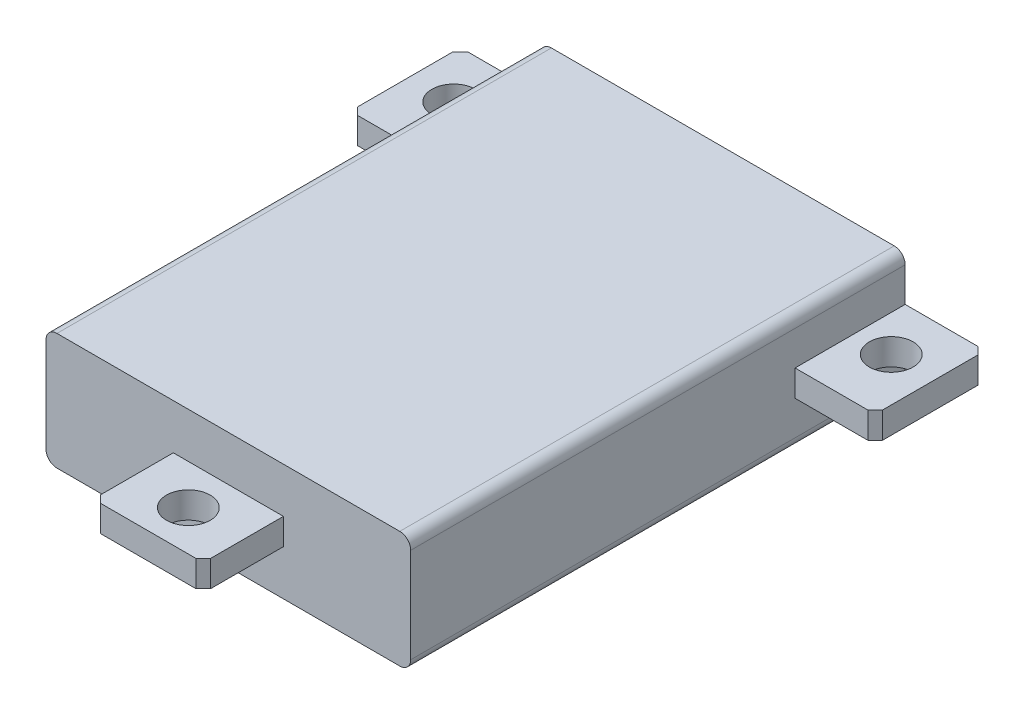
from build123d import *

# Parameters (mm, degrees)
SKETCH1_W           = 25.01
SKETCH1_H           = 33.905
BOSS_EXTRUDE1_DEPTH = 8
SKETCH2_W           = 7.55
SKETCH2_H           = 1.8
BOSS_EXTRUDE2_DEPTH = 5.495
SKETCH3_W           = 7.55
SKETCH3_H           = 1.8
BOSS_EXTRUDE3_DEPTH = 5.495
SKETCH6_R           = 1.5
CUT_EXTRUDE1_DEPTH  = 2
SKETCH8_R           = 1.5
CUT_EXTRUDE2_DEPTH  = 3
FILLET1_R           = 0.75
CHAMFER1_SIZE       = 0.5


with BuildPart() as part:
    # Sketch1 → Boss-Extrude1 (new body)
    with BuildSketch(Plane(origin=(0, 0, 0), x_dir=(1, 0, 0), z_dir=(0, 1, 0))):
        Rectangle(SKETCH1_W, SKETCH1_H)
    extrude(amount=BOSS_EXTRUDE1_DEPTH)

    # Sketch2 → Boss-Extrude2 (add)
    with BuildSketch(Plane.XY.offset(16.9525)):
        with Locations((0, 4)):
            Rectangle(SKETCH2_W, SKETCH2_H)
    extrude(amount=BOSS_EXTRUDE2_DEPTH)

    # Sketch3 → Boss-Extrude3 (add)
    with BuildSketch(Plane.ZY.offset(12.505)):
        with Locations((-13.1775, 4)):
            Rectangle(SKETCH3_W, SKETCH3_H)
    boss_extrude3 = extrude(amount=BOSS_EXTRUDE3_DEPTH)

    # Mirror2: Boss-Extrude3 across plane
    add(boss_extrude3.mirror(Plane(origin=(0, 0, 0), x_dir=(0, 0, 1), z_dir=(1, 0, 0))))

    # Sketch6 → Cut-Extrude1 (cut)
    with BuildSketch(Plane(origin=(0, 4.9, 0), x_dir=(1, 0, 0), z_dir=(0, 1, 0))):
        with Locations(Location((-15, 13.5025, 0), (0, 0, 270))):
            Circle(SKETCH6_R)
        with Locations(Location((15, 13.5025, 0), (0, 0, 270))):
            Circle(SKETCH6_R)
        with Locations(Location((0, -19.6975, 0), (0, 0, 270))):
            Circle(SKETCH6_R)
    extrude(amount=-CUT_EXTRUDE1_DEPTH, mode=Mode.SUBTRACT)

    # Sketch8 → Cut-Extrude2 (cut)
    with BuildSketch(Plane(origin=(0, 0, -16.9525), x_dir=(-1, 0, 0), z_dir=(0, 0, -1))):
        with Locations((-6.555, 4)):
            Circle(SKETCH8_R)
    extrude(amount=-CUT_EXTRUDE2_DEPTH, mode=Mode.SUBTRACT)

    # Fillet1
    fillet1_edges = [part.edges().sort_by_distance(p)[0] for p in [
        (-12.505, 8, 0),
        (12.505, 8, 0),
        (-12.505, 0, 0),
        (12.505, 0, 0),
    ]]
    fillet(fillet1_edges, radius=FILLET1_R)

    # Chamfer1
    chamfer1_edges = [part.edges().sort_by_distance(p)[0] for p in [
        (3.775, 4, 22.4475),
        (-3.775, 4, 22.4475),
        (-18, 4, -16.9525),
        (-18, 4, -9.4025),
        (18, 4, -16.9525),
        (18, 4, -9.4025),
    ]]
    chamfer(chamfer1_edges, length=CHAMFER1_SIZE)


solid = part.part
